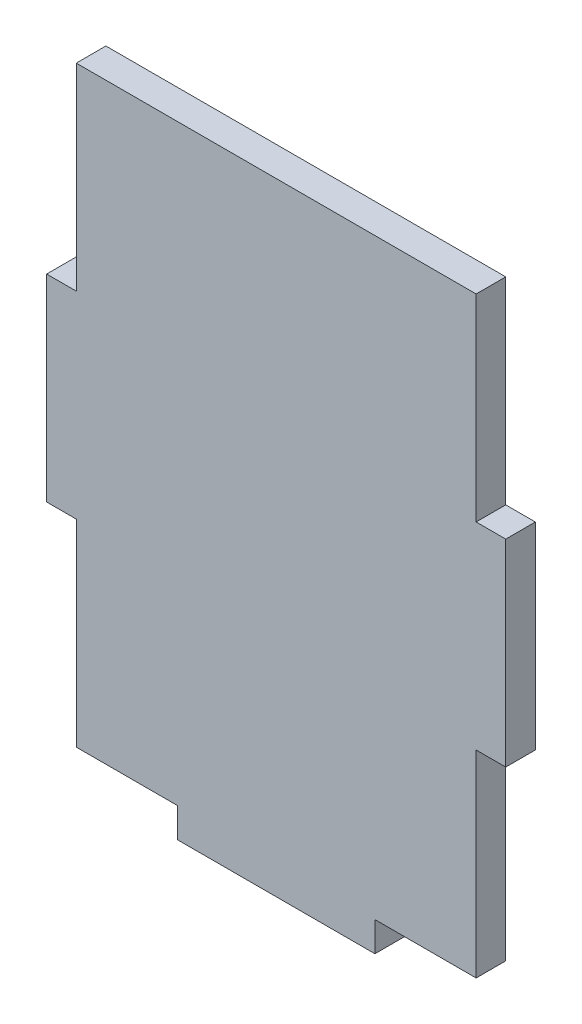
from build123d import *

# Parameters (mm, degrees)
SKETCH_1_W      = 40.5
SKETCH_1_H      = 60
SKETCH_1_W_2    = 3
SKETCH_1_H_2    = 20
SKETCH_1_W_3    = 20
SKETCH_1_H_3    = 3
EXTRUDE_1_DEPTH = 3


with BuildPart() as part:
    # 草图1 → 凸台-拉伸1 (new body)
    with BuildSketch(Plane.XY):
        with Locations((20.25, 30)):
            Rectangle(SKETCH_1_W, SKETCH_1_H)
        with Locations((42, 30)):
            Rectangle(SKETCH_1_W_2, SKETCH_1_H_2)
        with Locations((20.25, -1.5)):
            Rectangle(SKETCH_1_W_3, SKETCH_1_H_3)
        with Locations((-1.5, 30)):
            Rectangle(SKETCH_1_W_2, SKETCH_1_H_2)
    extrude(amount=EXTRUDE_1_DEPTH)


solid = part.part
